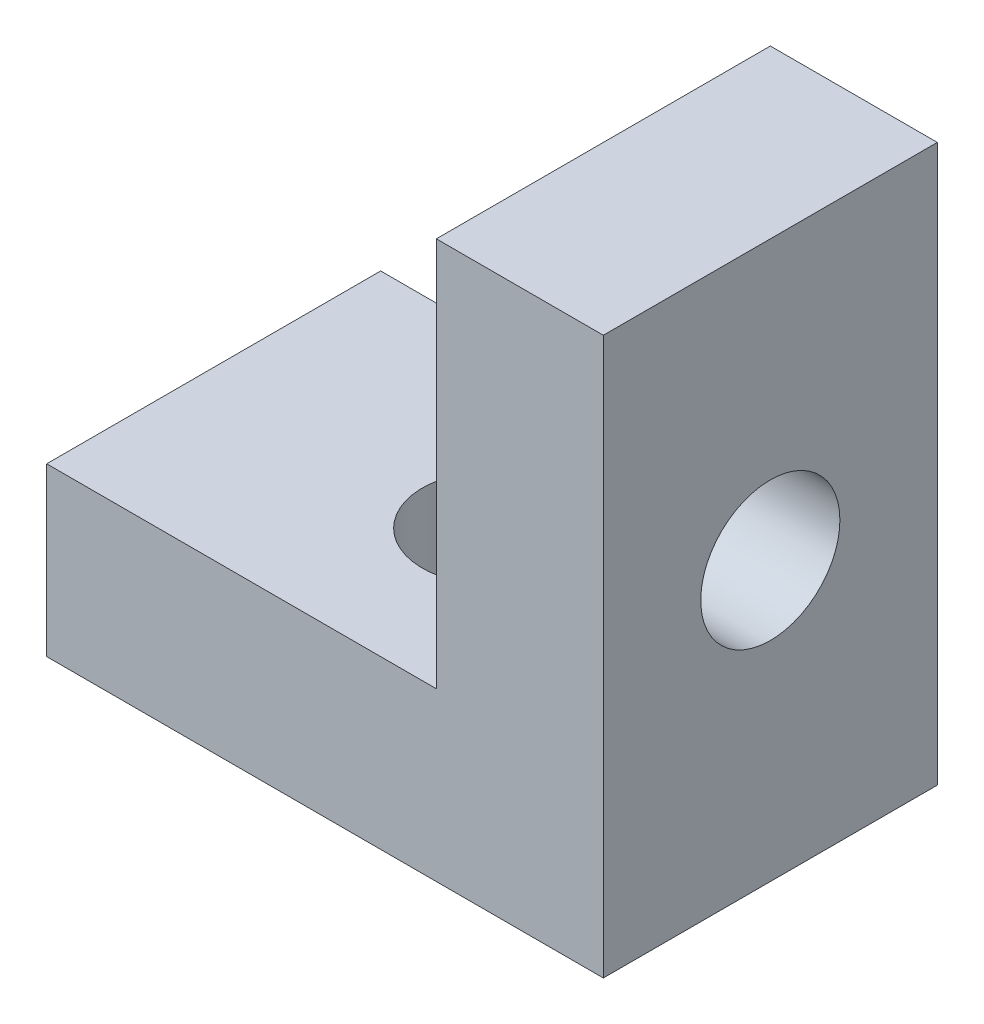
from build123d import *

# Parameters (mm, degrees)
EXTRUDE_1_DEPTH    = 6
HOLE_WIZARD_M3_1_D = 2.5
HOLE_WIZARD_M3_2_D = 2.5


with BuildPart() as part:
    # 草图1 → 凸台-拉伸1 (new body)
    with BuildSketch(Plane.XY):
        Polygon((0, 0), (0, -3), (10, -3), (10, 7), (7, 7), (7, 0), align=None)
    extrude(amount=EXTRUDE_1_DEPTH)

    # M3 螺纹孔1 (through all)
    with Locations(Plane(origin=(0, -3, 0), x_dir=(-1, 0, 0), z_dir=(0, -1, 0))):
        with Locations((-5, -3)):
            Hole(HOLE_WIZARD_M3_1_D / 2)

    # M3 螺纹孔2 (through all)
    with Locations(Plane(origin=(10, 0, 0), x_dir=(0, 0, -1), z_dir=(1, 0, 0))):
        with Locations((-3, 2)):
            Hole(HOLE_WIZARD_M3_2_D / 2)


solid = part.part
